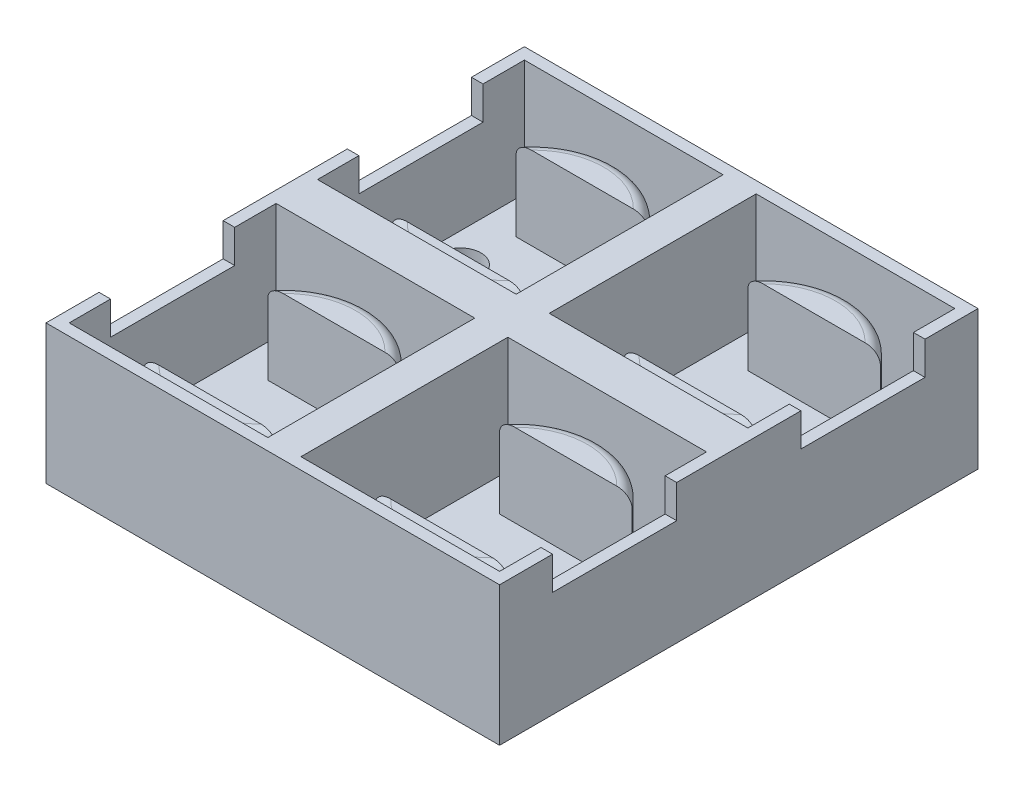
from build123d import *

# Parameters (mm, degrees)
SKETCH1_W            = 30.48
SKETCH1_H            = 31.75
BOSS_EXTRUDE1_DEPTH  = 3.556
BOSS_EXTRUDE2_DEPTH  = 12.7
SKETCH4_W            = 69.596
SKETCH4_H            = 73.406
SKETCH4_W_2          = 30.48
SKETCH4_H_2          = 31.75
BOSS_EXTRUDE3_DEPTH  = 3.556
BOSS_EXTRUDE5_DEPTH  = 12.7
MIRROR2_COPY_1_DEPTH = 12.7
MIRROR2_COPY_2_DEPTH = 12.7
MIRROR4_COPY_1_DEPTH = 12.7
MIRROR4_COPY_2_DEPTH = 12.7
FILLET5_R            = 1.778
SKETCH6_R            = 1.6
CUT_EXTRUDE1_DEPTH   = 80.692069935
BOSS_EXTRUDE7_REACH  = 82.336
SKETCH10_R           = 3.175
CUT_EXTRUDE2_DEPTH   = 2.54
BOSS_EXTRUDE8_DEPTH  = 5.08


with BuildPart() as part:
    # Sketch1 → Boss-Extrude1 (new body)
    with BuildSketch(Plane(origin=(0, 0, 0), x_dir=(1, 0, 0), z_dir=(0, 1, 0))):
        with Locations((15.24, 15.875)):
            Rectangle(SKETCH1_W, SKETCH1_H)
    extrude(amount=BOSS_EXTRUDE1_DEPTH)

    # Sketch2 → Boss-Extrude2 (add)
    with BuildSketch(Plane(origin=(0, 3.556, 0), x_dir=(1, 0, 0), z_dir=(0, 1, 0))):
        with BuildLine():
            ThreePointArc((25.4, 25.4), (15.24, 30.48), (5.08, 25.4))
            Line((5.08, 25.4), (25.4, 25.4))
        make_face()
        with BuildLine():
            Line((25.4, 6.35), (5.08, 6.35))
            ThreePointArc((5.08, 6.35), (15.24, 1.27), (25.4, 6.35))
        make_face()
    boss_extrude2 = extrude(amount=BOSS_EXTRUDE2_DEPTH)

    # Sketch4 → Boss-Extrude3 (add)
    with BuildSketch(Plane(origin=(0, 3.556, 0), x_dir=(1, 0, 0), z_dir=(0, 1, 0))):
        with Locations((33.02, -3.175)):
            Rectangle(SKETCH4_W, SKETCH4_H)
        with Locations((15.24, 15.875)):
            Rectangle(SKETCH4_W_2, SKETCH4_H_2, mode=Mode.SUBTRACT)
    extrude(amount=-BOSS_EXTRUDE3_DEPTH)

    # Sketch8 → Boss-Extrude5 (add)
    with BuildSketch(Plane(origin=(0, 3.556, 0), x_dir=(1, 0, 0), z_dir=(0, 1, 0))):
        Polygon((-1.778, 27.178), (-1.778, 33.528), (32.258, 33.528), (32.258, -1.778), (-1.778, -1.778), (-1.778, 4.572), align=None)
        Polygon((0, 31.75), (0, 27.178), (0, 4.572), (0, 0), (30.48, 0), (30.48, 31.75), align=None, mode=Mode.SUBTRACT)
    boss_extrude5 = extrude(amount=BOSS_EXTRUDE5_DEPTH)

    # Mirror1: Boss-Extrude5 across plane
    add(boss_extrude5.mirror(Plane(origin=(0, 0, 3.175), x_dir=(1, 0, 0), z_dir=(0, 0, -1))))

    # Mirror2 copy 1 sketch → Mirror2 copy 1 (add)
    with BuildSketch(Plane(origin=(66.04, 3.556, 6.35), x_dir=(-1, 0, 0), z_dir=(0, 1, 0))):
        Polygon((-1.778, 27.178), (-1.778, 33.528), (32.258, 33.528), (32.258, -1.778), (-1.778, -1.778), (-1.778, 4.572), align=None)
        Polygon((0, 31.75), (0, 27.178), (0, 4.572), (0, 0), (30.48, 0), (30.48, 31.75), align=None, mode=Mode.SUBTRACT)
    extrude(amount=MIRROR2_COPY_1_DEPTH)

    # Mirror2 copy 2 sketch → Mirror2 copy 2 (add)
    with BuildSketch(Plane(origin=(66.04, 3.556, 0), x_dir=(-1, 0, 0), z_dir=(0, 1, 0))):
        Polygon((-1.778, -27.178), (-1.778, -33.528), (32.258, -33.528), (32.258, 1.778), (-1.778, 1.778), (-1.778, -4.572), align=None)
        Polygon((0, -31.75), (0, -27.178), (0, -4.572), (0, 0), (30.48, 0), (30.48, -31.75), align=None, mode=Mode.SUBTRACT)
    extrude(amount=MIRROR2_COPY_2_DEPTH)

    # Mirror3: Boss-Extrude2 across plane
    add(boss_extrude2.mirror(Plane(origin=(0, 0, 3.175), x_dir=(1, 0, 0), z_dir=(0, 0, -1))))

    # Mirror4 copy 1 sketch → Mirror4 copy 1 (add)
    with BuildSketch(Plane(origin=(66.04, 3.556, 6.35), x_dir=(-1, 0, 0), z_dir=(0, 1, 0))):
        with BuildLine():
            ThreePointArc((25.4, 25.4), (15.24, 30.48), (5.08, 25.4))
            Line((5.08, 25.4), (25.4, 25.4))
        make_face()
        with BuildLine():
            Line((25.4, 6.35), (5.08, 6.35))
            ThreePointArc((5.08, 6.35), (15.24, 1.27), (25.4, 6.35))
        make_face()
    extrude(amount=MIRROR4_COPY_1_DEPTH)

    # Mirror4 copy 2 sketch → Mirror4 copy 2 (add)
    with BuildSketch(Plane(origin=(66.04, 3.556, 0), x_dir=(-1, 0, 0), z_dir=(0, 1, 0))):
        with BuildLine():
            ThreePointArc((25.4, -25.4), (15.24, -30.48), (5.08, -25.4))
            Line((5.08, -25.4), (25.4, -25.4))
        make_face()
        with BuildLine():
            Line((25.4, -6.35), (5.08, -6.35))
            ThreePointArc((5.08, -6.35), (15.24, -1.27), (25.4, -6.35))
        make_face()
    extrude(amount=MIRROR4_COPY_2_DEPTH)

    # Fillet5
    fillet5_edges = [part.edges().sort_by_distance(p)[0] for p in [
        (50.8, 16.256, 36.83),
        (15.24, 16.256, 36.83),
        (15.24, 16.256, 7.62),
        (15.24, 16.256, -1.27),
        (15.24, 16.256, -30.48),
        (50.8, 16.256, -30.48),
        (50.8, 16.256, -1.27),
        (50.8, 16.256, 7.62),
    ]]
    fillet(fillet5_edges, radius=FILLET5_R)

    # Sketch6 → Cut-Extrude1 (cut, through all)
    with BuildSketch(Plane(origin=(0, 3.556, 0), x_dir=(1, 0, 0), z_dir=(0, 1, 0))):
        with Locations((61.5442, 17.402175)):
            Circle(SKETCH6_R)
        with Locations((4.4958, 17.402175)):
            Circle(SKETCH6_R)
        with Locations((4.4958, -23.753445)):
            Circle(SKETCH6_R)
        with Locations((61.5442, -23.753445)):
            Circle(SKETCH6_R)
    extrude(amount=-CUT_EXTRUDE1_DEPTH, mode=Mode.SUBTRACT)

    # Sketch9 → Boss-Extrude7 (add, up to next)
    with BuildSketch(Plane(origin=(0, 16.256, 0), x_dir=(1, 0, 0), z_dir=(0, 1, 0)), mode=Mode.PRIVATE) as boss_extrude7_sk1:
        Polygon((33.782, 33.528), (32.258, 33.528), (32.258, -1.778), (-1.778, -1.778), (-1.778, -4.572), (32.258, -4.572), (32.258, -39.878), (33.782, -39.878), (33.782, -4.572), (67.818, -4.572), (67.818, -1.778), (33.782, -1.778), align=None)
    boss_extrude7_tool1 = extrude(boss_extrude7_sk1.sketch, amount=-BOSS_EXTRUDE7_REACH, mode=Mode.PRIVATE) - part.part
    add(boss_extrude7_tool1.solids().sort_by_distance((33.02, 16.256, 3.175))[0])

    # Sketch10 → Cut-Extrude2 (cut)
    with BuildSketch(Plane(origin=(0, 3.556, 0), x_dir=(1, 0, 0), z_dir=(0, 1, 0))):
        with Locations((61.5442, 17.402175)):
            Circle(SKETCH10_R)
        with Locations((4.4958, 17.402175)):
            Circle(SKETCH10_R)
        with Locations((4.4958, -23.753445)):
            Circle(SKETCH10_R)
        with Locations((61.5442, -23.753445)):
            Circle(SKETCH10_R)
    extrude(amount=-CUT_EXTRUDE2_DEPTH, mode=Mode.SUBTRACT)

    # Sketch12 → Boss-Extrude8 (add)
    with BuildSketch(Plane(origin=(0, 16.256, 0), x_dir=(1, 0, 0), z_dir=(0, 1, 0))):
        Polygon((-1.778, 25.4), (0, 25.4), (0, 31.75), (30.48, 31.75), (30.48, 0), (0, 0), (0, 6.35), (-1.778, 6.35), (-1.778, -12.7), (0, -12.7), (0, -6.35), (30.48, -6.35), (30.48, -38.1), (0, -38.1), (0, -31.75), (-1.778, -31.75), (-1.778, -39.878), (67.818, -39.878), (67.818, -31.75), (66.04, -31.75), (66.04, -38.1), (35.56, -38.1), (35.56, -6.35), (66.04, -6.35), (66.04, -12.7), (67.818, -12.7), (67.818, 6.35), (66.04, 6.35), (66.04, 0), (35.56, 0), (35.56, 31.75), (66.04, 31.75), (66.04, 25.4), (67.818, 25.4), (67.818, 33.528), (-1.778, 33.528), align=None)
    extrude(amount=BOSS_EXTRUDE8_DEPTH)


solid = part.part
